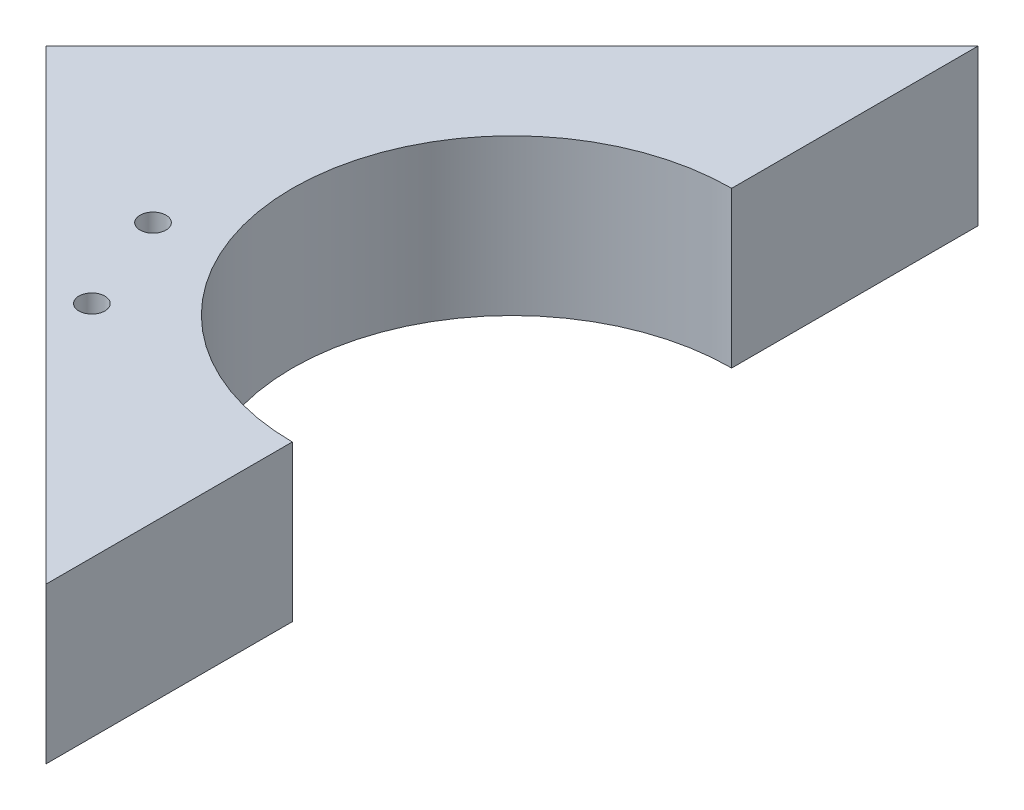
from build123d import *

# Parameters (mm, degrees)
SKETCH1_R           = 3
BOSS_EXTRUDE1_DEPTH = 36


with BuildPart() as part:
    # Sketch1 → Boss-Extrude1 (new body)
    with BuildSketch(Plane(origin=(0, 0, 0), x_dir=(1, 0, 0), z_dir=(0, 1, 0))):
        with BuildLine():
            Line((0, 0), (-107.763073453, 107.763073453))
            Line((-107.763073453, 107.763073453), (0, 215.526146906))
            Line((0, 215.526146906), (0, 158.563073453))
            ThreePointArc((0, 158.563073453), (-50.8, 107.763073453), (0, 56.963073453))
            Line((0, 56.963073453), (0, 0))
        make_face()
        with Locations(Location((-60.033365723, 84.782103064, 0), (0, 0, 270))):
            Circle(SKETCH1_R, mode=Mode.SUBTRACT)
        with Locations(Location((-50.902581789, 61.509183506, 0), (0, 0, 270))):
            Circle(SKETCH1_R, mode=Mode.SUBTRACT)
    extrude(amount=BOSS_EXTRUDE1_DEPTH)


solid = part.part
